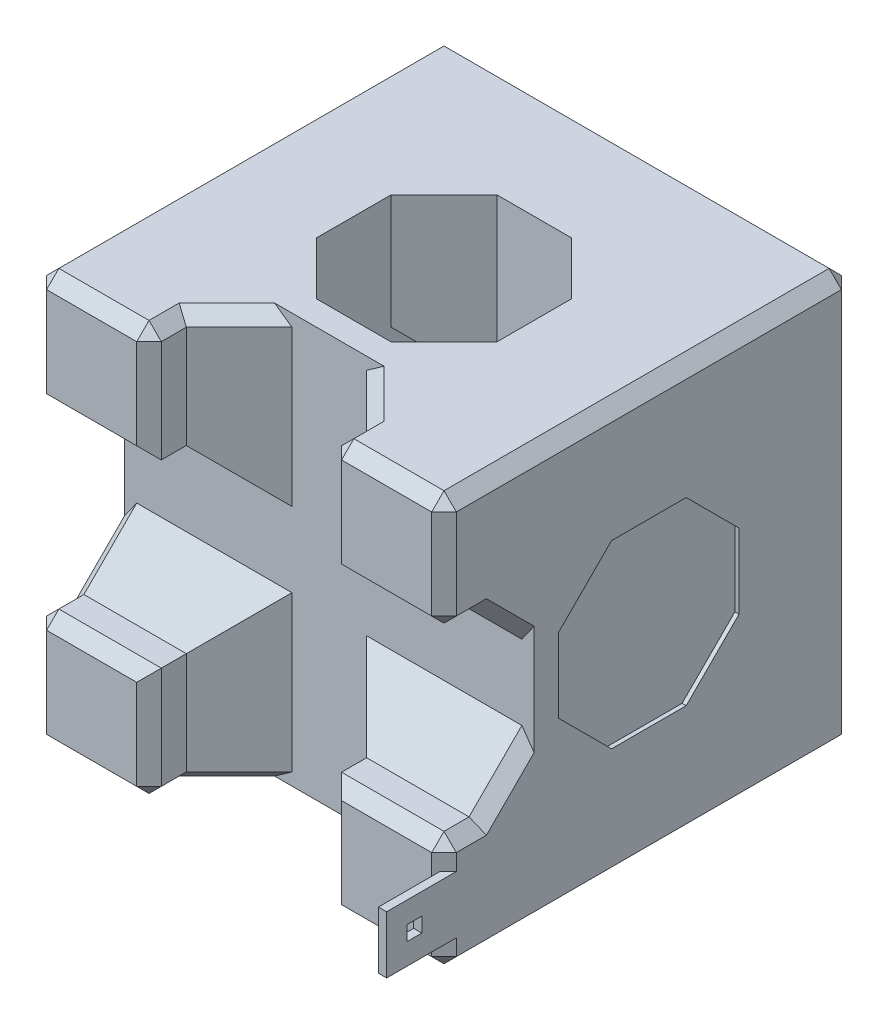
from build123d import *

# Parameters (mm, degrees)
SKETCH1_W                = 50
SKETCH1_H                = 50
BOSS_EXTRUDE1_DEPTH      = 50
CUT_EXTRUDE1_DEPTH       = 87.602540378
CUT_EXTRUDE2_DEPTH       = 87.602540378
CHAMFER1_SIZE            = 1.5
BOSS_EXTRUDE2_REACH      = 81.347
SKETCH11_W               = 0.5
SKETCH11_H               = 22
BOSS_EXTRUDE3_DEPTH      = 7
BOSS_EXTRUDE3_DEPTH_BACK = 10
SKETCH12_W               = 1
SKETCH12_H               = 7
SKETCH13_W               = 1.8
SKETCH13_H               = 1.8
CUT_EXTRUDE3_DEPTH       = 7


with BuildPart() as part:
    # Sketch1 → Boss-Extrude1 (new body)
    with BuildSketch(Plane.XY):
        with Locations((25, 25)):
            Rectangle(SKETCH1_W, SKETCH1_H)
    extrude(amount=BOSS_EXTRUDE1_DEPTH)

    # Sketch2 → Cut-Extrude1 (cut, through all)
    with BuildSketch(Plane.ZY):
        Polygon((45.443650814, 14), (54.556349186, 14), (61, 20.443650814), (61, 29.556349186), (54.556349186, 36), (45.443650814, 36), (39, 29.556349186), (39, 20.443650814), align=None)
        Polygon((36, 29.556349186), (29.556349186, 36), (20.443650814, 36), (14, 29.556349186), (14, 20.443650814), (20.443650814, 14), (29.556349186, 14), (36, 20.443650814), align=None)
    extrude(amount=-CUT_EXTRUDE1_DEPTH, mode=Mode.SUBTRACT)

    # Sketch10 → Cut-Extrude2 (cut, through all)
    with BuildSketch(Plane.XZ):
        Polygon((29.556349186, 36), (20.443650814, 36), (14, 29.556349186), (14, 20.443650814), (20.443650814, 14), (29.556349186, 14), (36, 20.443650814), (36, 29.556349186), align=None)
        Polygon((29.556349186, 39), (36, 45.443650814), (36, 54.556349186), (29.556349186, 61), (20.443650814, 61), (14, 54.556349186), (14, 45.443650814), (20.443650814, 39), align=None)
    extrude(amount=-CUT_EXTRUDE2_DEPTH, mode=Mode.SUBTRACT)

    # Chamfer1
    chamfer1_edges = [part.edges().sort_by_distance(p)[0] for p in [
        (50, 7, 50),
        (0, 7, 50),
        (50, 43, 50),
        (43, 14, 50),
        (7, 36, 50),
        (50, 36, 47.721825407),
        (50, 14, 47.721825407),
        (0, 14, 47.721825407),
        (0, 36, 47.721825407),
        (0, 32.778174593, 42.221825407),
        (0, 17.221825407, 42.221825407),
        (50, 17.221825407, 42.221825407),
        (50, 32.778174593, 42.221825407),
        (43, 50, 50),
        (7, 14, 50),
        (43, 36, 50),
        (43, 0, 50),
        (7, 50, 50),
        (36, 0, 47.721825407),
        (14, 0, 47.721825407),
        (17.221825407, 0, 42.221825407),
        (32.778174593, 0, 42.221825407),
        (14, 43, 50),
        (14, 50, 47.721825407),
        (14, 7, 50),
        (36, 50, 47.721825407),
        (36, 43, 50),
        (36, 7, 50),
        (17.221825407, 50, 42.221825407),
        (32.778174593, 50, 42.221825407),
        (0, 43, 50),
        (25, 50, 0),
        (50, 25, 0),
        (25, 0, 0),
        (0, 25, 0),
        (7, 0, 50),
        (0, 50, 25),
        (50, 50, 25),
        (50, 0, 25),
        (0, 0, 25),
    ]]
    chamfer(chamfer1_edges, length=CHAMFER1_SIZE)

    # Boss-Extrude2: up to this face of the body (flat: up to its plane)
    boss_extrude2_end = Plane(part.part.faces().sort_by_distance((25, 25, 39))[0])
    # Sketch11 → Boss-Extrude2 (add, up to the picked face)
    with BuildSketch(Plane.XY.offset(14), mode=Mode.PRIVATE) as boss_extrude2_sk1:
        with Locations((36.25, 25)):
            Rectangle(SKETCH11_W, SKETCH11_H)
    boss_extrude2_tool1 = split(extrude(boss_extrude2_sk1.sketch, amount=BOSS_EXTRUDE2_REACH, mode=Mode.PRIVATE), bisect_by=boss_extrude2_end, keep=Keep.BOTH, mode=Mode.PRIVATE)
    # Sketch11 → Boss-Extrude2 (add, up to the picked face)
    with BuildSketch(Plane.XY.offset(14), mode=Mode.PRIVATE) as boss_extrude2_sk2:
        with Locations((13.75, 25)):
            Rectangle(SKETCH11_W, SKETCH11_H)
    boss_extrude2_tool2 = split(extrude(boss_extrude2_sk2.sketch, amount=BOSS_EXTRUDE2_REACH, mode=Mode.PRIVATE), bisect_by=boss_extrude2_end, keep=Keep.BOTH, mode=Mode.PRIVATE)
    # Sketch11 → Boss-Extrude2 (add, up to the picked face)
    with BuildSketch(Plane.XY.offset(14), mode=Mode.PRIVATE) as boss_extrude2_sk3:
        with Locations((49.25, 25)):
            Rectangle(SKETCH11_W, SKETCH11_H)
    boss_extrude2_tool3 = split(extrude(boss_extrude2_sk3.sketch, amount=BOSS_EXTRUDE2_REACH, mode=Mode.PRIVATE), bisect_by=boss_extrude2_end, keep=Keep.BOTH, mode=Mode.PRIVATE)
    # Sketch11 → Boss-Extrude2 (add, up to the picked face)
    with BuildSketch(Plane.XY.offset(14), mode=Mode.PRIVATE) as boss_extrude2_sk4:
        with Locations((0.75, 25)):
            Rectangle(SKETCH11_W, SKETCH11_H)
    boss_extrude2_tool4 = split(extrude(boss_extrude2_sk4.sketch, amount=BOSS_EXTRUDE2_REACH, mode=Mode.PRIVATE), bisect_by=boss_extrude2_end, keep=Keep.BOTH, mode=Mode.PRIVATE)
    add(boss_extrude2_tool1.solids().sort_by(Axis((36.25, 25, 14), (0, 0, 1)))[0])
    add(boss_extrude2_tool2.solids().sort_by(Axis((13.75, 25, 14), (0, 0, 1)))[0])
    add(boss_extrude2_tool3.solids().sort_by(Axis((49.25, 25, 14), (0, 0, 1)))[0])
    add(boss_extrude2_tool4.solids().sort_by(Axis((0.75, 25, 14), (0, 0, 1)))[0])

    # Sketch12 → Boss-Extrude3 (add, two sides: drawn at the far end of the back side and taken through both)
    with BuildSketch(Plane.XY.offset(50).offset(-BOSS_EXTRUDE3_DEPTH_BACK)):
        with Locations((49.5, 7)):
            Rectangle(SKETCH12_W, SKETCH12_H)
    extrude(amount=BOSS_EXTRUDE3_DEPTH + BOSS_EXTRUDE3_DEPTH_BACK)

    # Sketch13 → Cut-Extrude3 (cut)
    with BuildSketch(Plane(origin=(50, 0, 0), x_dir=(0, 0, -1), z_dir=(1, 0, 0))):
        with Locations((-53.6, 7)):
            Rectangle(SKETCH13_W, SKETCH13_H)
    extrude(amount=-CUT_EXTRUDE3_DEPTH, mode=Mode.SUBTRACT)


solid = part.part
